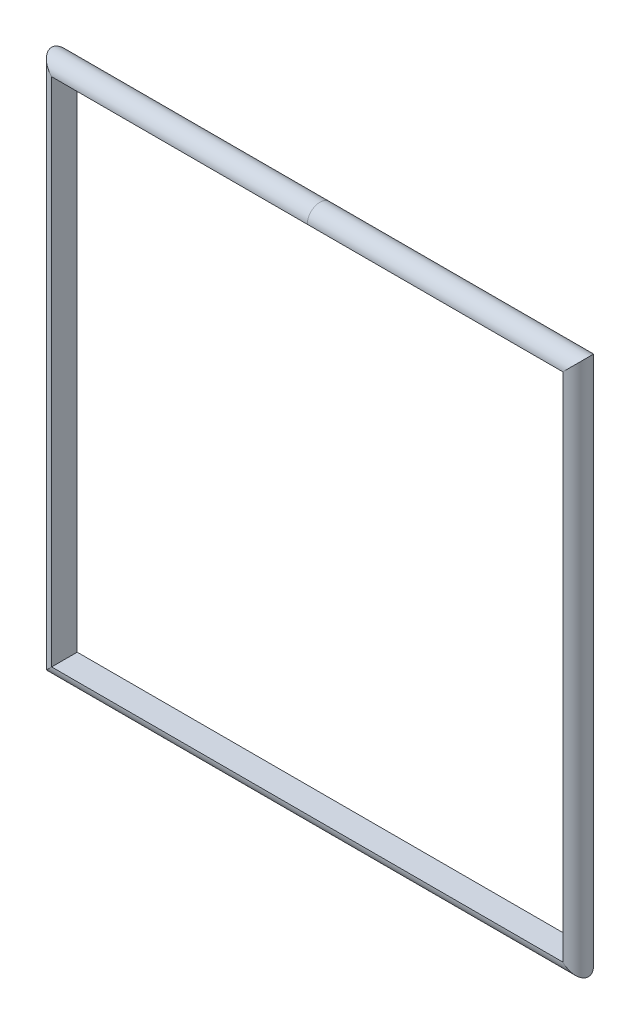
from build123d import *


with BuildPart() as part:
    # Sweep2: sweep along a path in Sketch2
    with BuildLine(Plane.XY) as sweep2_path:
        Line((-0.3, -0.3), (0.3, -0.3))
        Line((0.3, -0.3), (0.3, 0.3))
        Line((0.3, 0.3), (-0.3, 0.3))
        Line((-0.3, 0.3), (-0.3, -0.3))
    # Sketch1 → Sweep2 (sweep)
    with BuildSketch(Plane(origin=(0, 0, 0), x_dir=(0, 0, -1), z_dir=(1, 0, 0))):
        with BuildLine():
            Line((-0.015, 0.3), (0.015, 0.3))
            ThreePointArc((0.015, 0.3), (0, 0.315), (-0.015, 0.3))
        make_face()
    sweep(path=sweep2_path.line, transition=Transition.RIGHT)


solid = part.part
